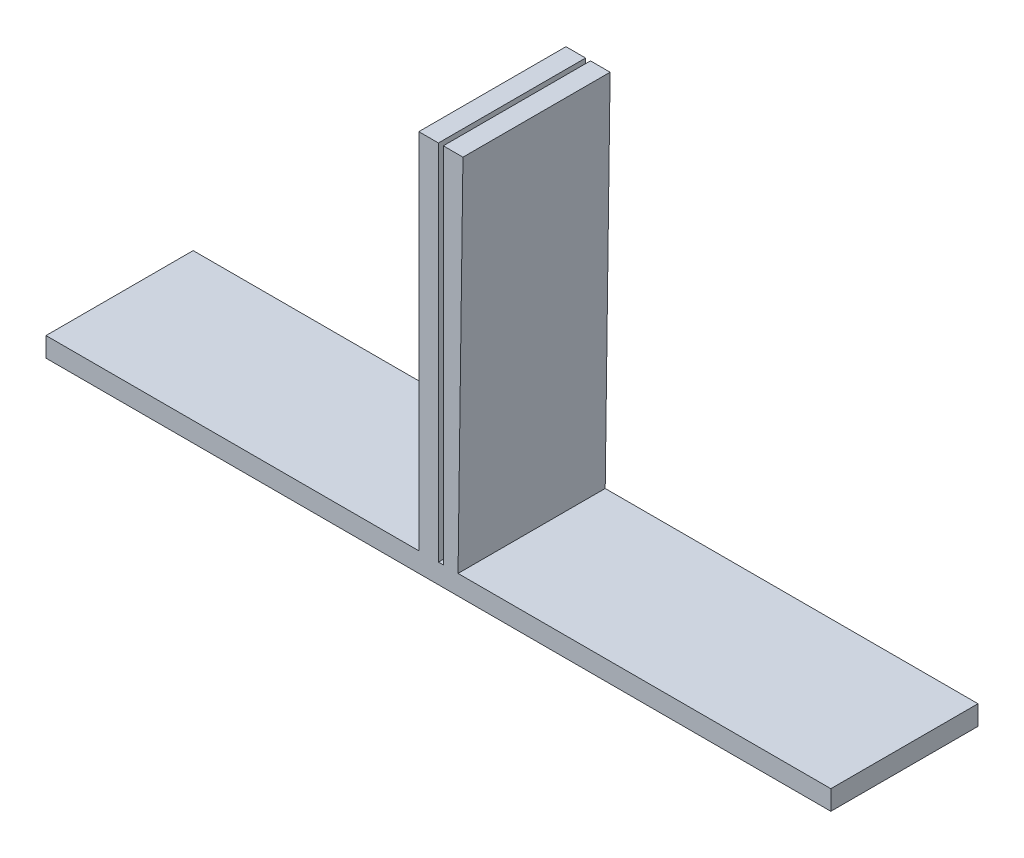
from build123d import *

# Parameters (mm, degrees)
BOSS_EXTRU_1_DEPTH = 15


with BuildPart() as part:
    # Esquisse1 → Boss.-Extru.1 (new body)
    with BuildSketch(Plane.XY):
        Polygon((37.196716412, 0), (-42.803283588, 0), (-42.803283588, 2), (-4.803283588, 2), (-4.803283588, 39), (-2.803283588, 39), (-2.803283588, 2), (-2.303283588, 2), (-2.303283588, 39), (-0.303286441, 38.996621506), (-0.803283588, 2), (37.196716412, 2), align=None)
    extrude(amount=BOSS_EXTRU_1_DEPTH)


solid = part.part
